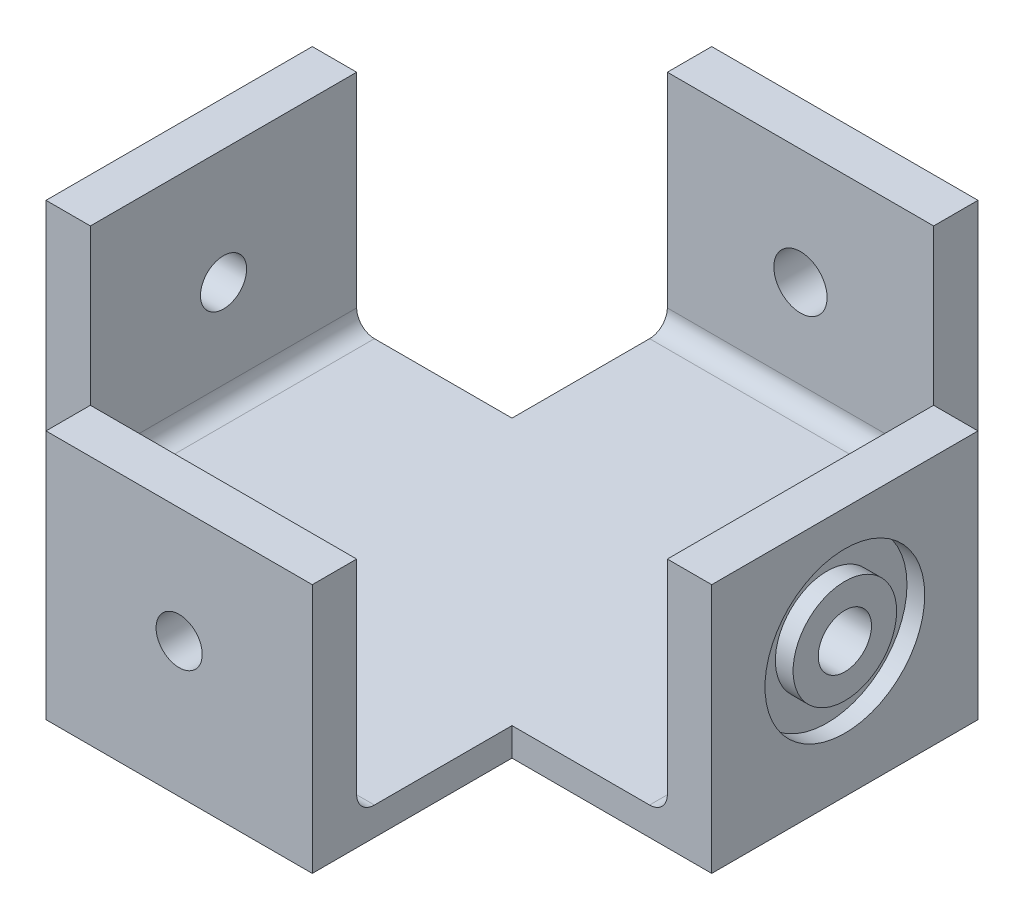
from build123d import *

# Parameters (mm, degrees)
BOSS_EXTRUDE1_DEPTH = 3.175
SKETCH4_W           = 5
SKETCH4_H           = 30
BOSS_EXTRUDE3_DEPTH = 25
FILLET1_R           = 2
SKETCH5_W           = 30
SKETCH5_H           = 5
BOSS_EXTRUDE4_DEPTH = 25
FILLET2_R           = 2
SKETCH6_R           = 2.6
CUT_EXTRUDE1_DEPTH  = 10
CIRPATTERN1_COUNT   = 2
CIRPATTERN1_ANGLE   = 90
SKETCH7_R           = 3
CUT_EXTRUDE2_DEPTH  = 10
CIRPATTERN2_COUNT   = 2
CIRPATTERN2_ANGLE   = 90
SKETCH10_R          = 9
SKETCH10_R_2        = 5.83
CUT_EXTRUDE9_DEPTH  = 2
CIRPATTERN4_COUNT   = 2
CIRPATTERN4_ANGLE   = 270


with BuildPart() as part:
    # Sketch1 → Boss-Extrude1 (new body)
    with BuildSketch(Plane(origin=(0, 0, 0), x_dir=(1, 0, 0), z_dir=(0, 1, 0))):
        Polygon((-15, 15), (-15, 37.5), (15, 37.5), (15, 15), (37.5, 15), (37.5, -15), (15, -15), (15, -37.5), (-15, -37.5), (-15, -15), (-37.5, -15), (-37.5, 15), align=None)
    extrude(amount=BOSS_EXTRUDE1_DEPTH)

    # Sketch4 → Boss-Extrude3 (add)
    with BuildSketch(Plane(origin=(0, 3.175, 0), x_dir=(1, 0, 0), z_dir=(0, 1, 0))):
        with Locations((-35, 0)):
            Rectangle(SKETCH4_W, SKETCH4_H)
        with Locations((35, 0)):
            Rectangle(SKETCH4_W, SKETCH4_H)
    extrude(amount=BOSS_EXTRUDE3_DEPTH)

    # Fillet1
    fillet1_edges = [part.edges().sort_by_distance(p)[0] for p in [
        (-32.5, 3.175, 0),
        (32.5, 3.175, 0),
    ]]
    fillet(fillet1_edges, radius=FILLET1_R)

    # Sketch5 → Boss-Extrude4 (add)
    with BuildSketch(Plane(origin=(0, 3.175, 0), x_dir=(1, 0, 0), z_dir=(0, 1, 0))):
        with Locations((0, -35)):
            Rectangle(SKETCH5_W, SKETCH5_H)
        with Locations((0, 35)):
            Rectangle(SKETCH5_W, SKETCH5_H)
    extrude(amount=BOSS_EXTRUDE4_DEPTH)

    # Fillet2
    fillet2_edges = [part.edges().sort_by_distance(p)[0] for p in [
        (0, 3.175, 32.5),
        (0, 3.175, -32.5),
    ]]
    fillet(fillet2_edges, radius=FILLET2_R)

    # Sketch6 → Cut-Extrude1 (cut)
    with BuildSketch(Plane.ZY.offset(37.5)):
        with Locations((0, 15.175)):
            Circle(SKETCH6_R)
    cut_extrude1 = extrude(amount=-CUT_EXTRUDE1_DEPTH, mode=Mode.SUBTRACT)

    # CirPattern1: Cut-Extrude1 ×2 about axis
    cirpattern1_axis = Axis((0, 3.175, 0), (0, 1, 0))
    for i in range(1, CIRPATTERN1_COUNT):
        add(cut_extrude1.rotate(cirpattern1_axis, i * CIRPATTERN1_ANGLE / (CIRPATTERN1_COUNT - 1)), mode=Mode.SUBTRACT)

    # Sketch7 → Cut-Extrude2 (cut)
    with BuildSketch(Plane(origin=(37.5, 0, 0), x_dir=(0, 0, -1), z_dir=(1, 0, 0))):
        with Locations((0, 15.175)):
            Circle(SKETCH7_R)
    cut_extrude2 = extrude(amount=-CUT_EXTRUDE2_DEPTH, mode=Mode.SUBTRACT)

    # CirPattern2: Cut-Extrude2 ×2 about axis
    cirpattern2_axis = Axis((0, 3.175, 0), (0, 1, 0))
    for i in range(1, CIRPATTERN2_COUNT):
        add(cut_extrude2.rotate(cirpattern2_axis, i * CIRPATTERN2_ANGLE / (CIRPATTERN2_COUNT - 1)), mode=Mode.SUBTRACT)

    # Sketch10 → Cut-Extrude9 (cut)
    with BuildSketch(Plane(origin=(0, 0, -37.5), x_dir=(-1, 0, 0), z_dir=(0, 0, -1))):
        with Locations((0, 15.175)):
            Circle(SKETCH10_R)
        with Locations((0, 15.175)):
            Circle(SKETCH10_R_2, mode=Mode.SUBTRACT)
    cut_extrude9 = extrude(amount=-CUT_EXTRUDE9_DEPTH, mode=Mode.SUBTRACT)

    # CirPattern4: Cut-Extrude9 ×2 about axis
    cirpattern4_axis = Axis((0, 3.175, 0), (0, 1, 0))
    for i in range(1, CIRPATTERN4_COUNT):
        add(cut_extrude9.rotate(cirpattern4_axis, i * CIRPATTERN4_ANGLE / (CIRPATTERN4_COUNT - 1)), mode=Mode.SUBTRACT)


solid = part.part
